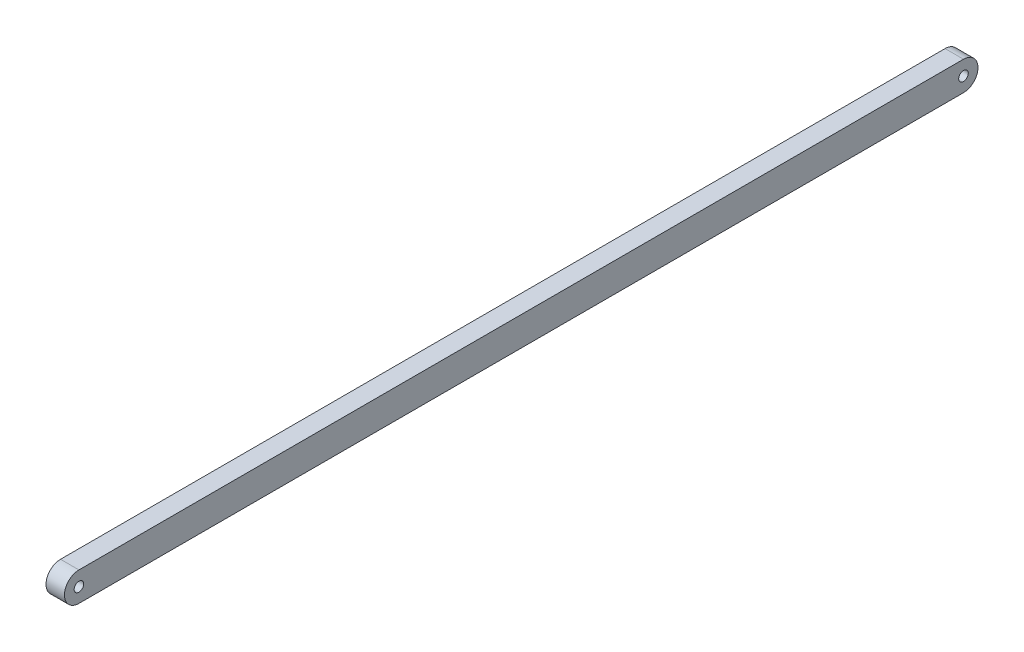
from build123d import *

# Parameters (mm, degrees)
SKETCH1_R           = 1.65
BOSS_EXTRUDE1_DEPTH = 6.35


with BuildPart() as part:
    # Sketch1 → Boss-Extrude1 (new body)
    with BuildSketch(Plane(origin=(0, 0, 0), x_dir=(0, 0, -1), z_dir=(1, 0, 0))):
        with BuildLine():
            Line((-152.4, 5), (152.4, 5))
            ThreePointArc((152.4, 5), (157.4, 0), (152.4, -5))
            Line((152.4, -5), (-152.4, -5))
            ThreePointArc((-152.4, -5), (-157.4, 0), (-152.4, 5))
        make_face()
        with Locations((-152.4, 0)):
            Circle(SKETCH1_R, mode=Mode.SUBTRACT)
        with Locations(Location((152.4, 0, 0), (0, 0, 180))):
            Circle(SKETCH1_R, mode=Mode.SUBTRACT)
    extrude(amount=BOSS_EXTRUDE1_DEPTH)


solid = part.part
